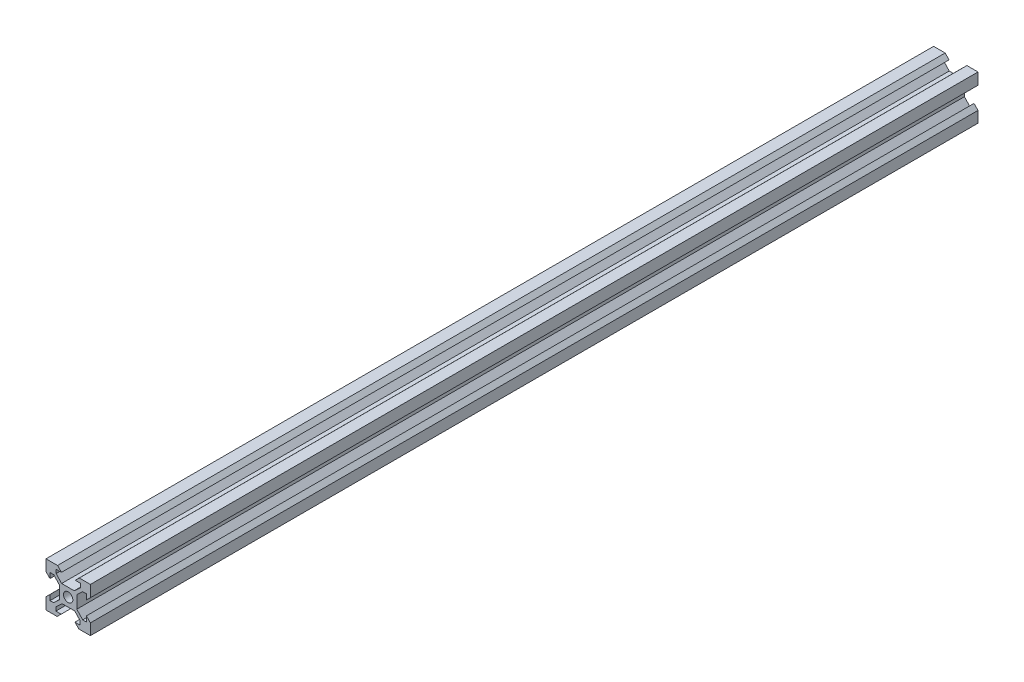
from build123d import *

# Parameters (mm, degrees)
SZKIC1_R                    = 2.1
DODANIE_WYCI_GNI_CIE1_DEPTH = 400


with BuildPart() as part:
    # Szkic1 → Dodanie-wyciągnięcie1 (new body)
    with BuildSketch(Plane.XY):
        Polygon((7.039765266, 13.885512537), (12.719765266, 13.885512537), (15.569105371, 16.538765319), (15.569105371, 18.199594156), (13.169105371, 18.199594156), (15, 20), (20, 20), (20, 14.801319399), (18.199594156, 13.030894629), (18.199594156, 15.430894629), (16.538765319, 15.430894629), (13.885512537, 12.960234734), (13.885512537, 7.280234734), (16.538765319, 4.430894629), (18.199594156, 4.430894629), (18.199594156, 6.830894629), (20, 5), (20, 0), (14.801319399, 0), (13.030894629, 1.800405844), (15.430894629, 1.800405844), (15.430894629, 3.461234681), (12.960234734, 6.114487463), (7.280234734, 6.114487463), (4.430894629, 3.461234681), (4.430894629, 1.800405844), (6.830894629, 1.800405844), (5, 0), (0, 0), (0, 5.198680601), (1.800405844, 6.969105371), (1.800405844, 4.569105371), (3.461234681, 4.569105371), (6.114487463, 7.039765266), (6.114487463, 12.719765266), (3.461234681, 15.569105371), (1.800405844, 15.569105371), (1.800405844, 13.169105371), (0, 15), (0, 20), (5.198680601, 20), (6.969105371, 18.199594156), (4.569105371, 18.199594156), (4.569105371, 16.538765319), align=None)
        with Locations((10, 10)):
            Circle(SZKIC1_R, mode=Mode.SUBTRACT)
    extrude(amount=DODANIE_WYCI_GNI_CIE1_DEPTH)


solid = part.part
